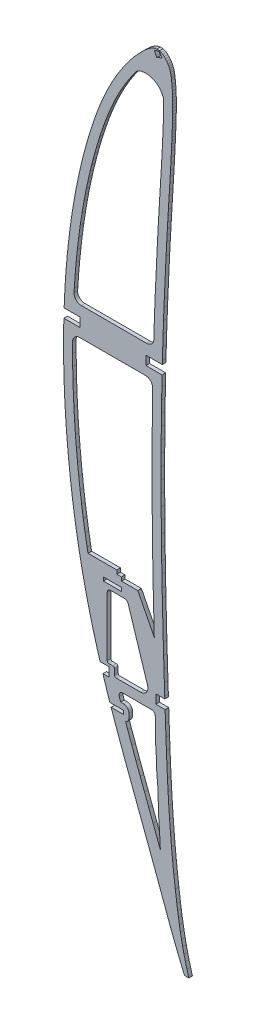
from build123d import *

# Parameters (mm, degrees)
EXTRUDE_1_DEPTH = 2


with BuildPart() as part:
    # Model → 凸台-拉伸1 (new body)
    with BuildSketch(Plane.XY):
        Polygon((54.291294518, 117.084195452), (54.291294518, 119.084195452), (46.872908152, 119.084195452), (45.566594013, 122.943410758), (43.487564441, 129.340813672), (42.984717155, 130.964481072), (46.441341872, 130.964481072), (46.441341872, 135.964481072), (41.441341872, 135.964481072), (40.610906377, 138.784323739), (39.68133891, 141.940780823), (37.91120231, 148.278600749), (36.233061187, 154.641457291), (34.646959161, 161.0283514), (33.154937948, 167.438371268), (31.757996596, 173.871560512), (30.476918009, 180.21872174), (29.288271093, 186.580929102), (28.189015084, 192.959050786), (27.17424198, 199.350870602), (26.243951782, 205.756388547), (25.394235534, 212.173432048), (24.622052473, 218.602869296), (23.929321852, 225.000742168), (23.312388037, 231.404927258), (22.771294649, 237.814425518), (22.307084354, 244.228281519), (21.920668962, 250.648536977), (21.612092093, 257.074192843), (21.383395463, 263.504337309), (21.234273734, 269.945963712), (21.167248438, 276.387170711), (21.18431767, 282.828045546), (21.28548143, 289.268588217), (21.310418054, 290.964481072), (30.408699099, 290.964481072), (30.408699099, 295.964481072), (29.408875314, 295.964481072), (21.485883025, 295.964481072), (21.751300161, 302.144161638), (22.119951326, 308.579366865), (22.585584814, 315.085870262), (23.150734747, 321.582705303), (23.818441889, 328.069003799), (24.592833293, 334.541943081), (25.480989532, 340.99983039), (26.485994993, 347.440798487), (27.611976724, 353.862024705), (28.235877227, 357.133352442), (28.893095277, 360.398127232), (29.582675444, 363.65530641), (30.307658493, 366.904021783), (31.065959088, 370.146184211), (31.859662565, 373.379882835), (32.689767972, 376.605161275), (33.578542915, 379.908072733), (34.507890457, 383.198742292), (35.479808697, 386.47725719), (36.497425636, 389.74075114), (37.562695751, 392.99031043), (38.678747047, 396.223068774), (39.848576666, 399.439157028), (40.477722629, 401.100180917), (41.122159651, 402.754865758), (41.782886781, 404.403255172), (42.461033924, 406.042395634), (43.15751289, 407.674328858), (43.504753325, 408.490251851), (44.24015575, 410.101863552), (45.401366069, 412.586880019), (46.218420336, 414.254106256), (47.058976146, 415.91034716), (47.925075213, 417.554690921), (48.817585727, 419.190178305), (49.737550357, 420.815853881), (50.684881863, 422.433715747), (51.740089589, 424.171397149), (52.827052958, 425.892447885), (53.942992924, 427.591741854), (55.085174058, 429.263153909), (56.251947218, 430.898604426), (57.440489737, 432.493966353), (58.650107903, 434.042202735), (59.402401981, 434.968899351), (60.168294358, 435.882176345), (60.953517606, 436.788289721), (61.765715157, 437.695580821), (62.609664153, 438.609262982), (63.493008026, 439.537677545), (64.421479349, 440.487080517), (65.717066034, 441.762807424), (67.085068203, 443.007663668), (68.506952724, 444.141764812), (69.963143803, 445.086181851), (71.439060883, 445.762203873), (72.913173689, 446.089815584), (74.369946238, 445.989263407), (74.96913356, 445.782849789), (75.262202885, 445.681890544), (76.126951759, 445.202153757), (76.951981987, 444.577546583), (77.72217279, 443.833433603), (78.426355963, 442.996352926), (79.050366155, 442.092711803), (79.581037063, 441.148961101), (79.967566521, 440.297010411), (80.281514413, 439.43388312), (80.531697697, 438.563967995), (80.731147619, 437.68683304), (80.888855612, 436.80287083), (81.016723016, 435.914602893), (81.123697647, 435.023420853), (81.289353677, 433.430130208), (81.427254453, 431.830622979), (81.538311786, 430.226940882), (81.624480152, 428.620170204), (81.687714028, 427.011397231), (81.729012462, 425.400665584), (81.750286313, 423.790060597), (81.752621867, 422.177627794), (81.73892903, 420.565496129), (81.71111866, 418.955750937), (81.67227514, 417.34652498), (81.623441138, 415.736862829), (81.568569227, 414.12793801), (81.508702075, 412.518795094), (81.446967684, 410.906567794), (81.383191578, 409.295252304), (81.316418327, 407.683805956), (81.24764698, 406.072272369), (81.175878488, 404.460607924), (81.1021119, 402.84885624), (81.024349118, 401.236930079), (80.860962028, 398.009731656), (80.686541788, 394.783052469), (80.503042875, 391.557978803), (80.312507005, 388.33359885), (80.117974943, 385.109044419), (79.921444784, 381.88440275), (79.723959196, 378.658718412), (79.528471704, 375.433121314), (79.333983261, 372.207567835), (79.142448343, 368.983144263), (78.953954189, 365.7578525), (78.769456228, 362.532735215), (78.586999983, 359.30670612), (78.409582598, 356.079896075), (78.043082277, 349.175129618), (77.056753567, 328.078030658), (76.880995939, 323.849543907), (76.63301571, 317.401590139), (76.405234542, 310.949513516), (76.199995289, 304.508430622), (76.014737001, 298.068220116), (75.96106674, 295.964481072), (67.89728713, 295.964481072), (66.89728713, 295.964481072), (66.89728713, 290.964481072), (75.835677054, 290.964481072), (75.707204083, 285.189548076), (75.585016691, 278.749088446), (75.48394017, 272.306547679), (75.4039309, 265.862924823), (75.344639927, 259.426212263), (75.305286298, 252.991371139), (75.284870967, 246.558357831), (75.28352479, 240.124175196), (75.299162434, 233.69073409), (75.332870184, 227.256080036), (75.382693563, 220.819126748), (75.448327237, 214.386867563), (75.528903015, 207.956261718), (75.624420896, 201.527309211), (75.734968121, 195.098011947), (75.860457449, 188.670368022), (75.962820782, 183.921690481), (76.502602245, 162.82459152), (76.688193548, 156.529882743), (76.886613396, 150.105423033), (77.09306925, 143.68031323), (77.199815655, 140.467411472), (77.30656206, 137.254509714), (77.350430551, 135.964481072), (72.350430551, 135.964481072), (72.350430551, 130.964481072), (77.520459684, 130.964481072), (77.525137351, 130.826926199), (77.748707882, 124.399560781), (77.982181657, 117.974629654), (78.008994214, 117.289629737), (78.2336383, 111.550483675), (78.50998391, 105.129426277), (78.817300014, 98.709721081), (79.164621667, 92.290761611), (79.557943158, 85.872809585), (80.004563159, 79.449177001), (80.508997099, 73.031071486), (81.072244026, 66.61853666), (81.701297277, 60.211877858), (82.39719952, 53.810139651), (83.165901426, 47.414582804), (84.010443757, 41.024339128), (84.466121807, 37.809155382), (84.948599681, 34.599145554), (85.463871669, 31.394571357), (86.017801202, 28.198691655), (86.618337046, 25.01285445), (87.271429872, 21.838320506), (87.983030348, 18.676350588), (88.772739459, 15.467743332), (89.620868983, 12.273698199), (90.516516627, 9.091737279), (90.678135484, 8.543704345), (88.290044891, 8.543704345), (88.096560118, 8.992085412), (86.754381538, 12.153549418), (85.435787541, 15.325051723), (84.143688033, 18.508721282), (82.902286663, 21.654566262), (81.687554259, 24.808582303), (80.493452914, 27.971506737), (79.315074623, 31.141123371), (78.148554052, 34.314260582), (76.985942436, 37.489570367), (75.823243581, 40.666878248), (73.487205296, 47.013021812), (71.133576717, 53.349388792), (68.768177657, 59.680237099), (66.39396164, 66.006696639), (64.012795905, 72.331851794), (61.629632074, 78.656919711), (59.246293765, 84.985983821), (56.882290525, 91.284862585), (54.536095675, 97.58852269), (52.219523317, 103.901483763), (49.944387552, 110.228265429), (47.955682015, 115.908270321), (47.549892479, 117.084195452), align=None)
        Polygon((43.286670067, 175.595272971), (43.286670067, 177.595272971), (50.744475201, 177.595272971), (53.286670067, 177.595272971), (53.286670067, 175.595272971), align=None, mode=Mode.SUBTRACT)
        with BuildLine():
            Line((72.042587935, 125.21439261), (72.218298993, 117.757054558))
            Line((72.218298993, 117.757054558), (72.3082212, 111.008200621))
            Line((72.3082212, 111.008200621), (72.71110218, 105.094867242))
            Line((72.71110218, 105.094867242), (72.890342146, 98.413249714))
            Line((72.890342146, 98.413249714), (73.471849335, 91.967229934))
            Line((73.471849335, 91.967229934), (73.696859108, 85.832325294))
            Line((73.696859108, 85.832325294), (73.791319576, 79.278176163))
            Line((73.791319576, 79.278176163), (74.314109024, 72.701131933))
            Line((74.314109024, 72.701131933), (74.664835741, 66.384594583))
            Line((74.664835741, 66.384594583), (74.864626279, 62.283566149))
            Line((74.864626279, 62.283566149), (73.204330163, 66.707677572))
            Line((73.204330163, 66.707677572), (70.822801347, 73.033797189))
            Line((70.822801347, 73.033797189), (68.439439292, 79.359391429))
            Line((68.439439292, 79.359391429), (66.056621443, 85.687073528))
            Line((66.056621443, 85.687073528), (63.693966415, 91.982359986))
            Line((63.693966415, 91.982359986), (61.35033172, 98.279141574))
            Line((61.35033172, 98.279141574), (59.037584921, 104.581677502))
            Line((59.037584921, 104.581677502), (56.767495816, 110.894425226))
            Line((56.767495816, 110.894425226), (55.6090916, 114.202980212))
            ThreePointArc((55.6090916, 114.202980212), (56.941486452, 115.308561958), (57.441084292, 116.966267915))
            Line((57.441084292, 116.966267915), (57.441084292, 119.190880387))
            ThreePointArc((57.441084292, 119.190880387), (56.562404636, 121.312200731), (54.441084292, 122.190880387))
            Line((54.441084292, 122.190880387), (52.87012438, 122.190880387))
            Line((52.87012438, 122.190880387), (52.079692184, 124.526036946))
            ThreePointArc((52.079692184, 124.526036946), (52.34891593, 126.332938072), (53.974106504, 127.167281348))
            Line((53.974106504, 127.167281348), (70.04314288, 127.167281348))
            ThreePointArc((70.04314288, 127.167281348), (71.440600836, 126.598054307), (72.042587935, 125.21439261))
        make_face(mode=Mode.SUBTRACT)
        with BuildLine():
            Line((45.360727752, 138.485291105), (45.360727752, 171.110887324))
            ThreePointArc((45.360727752, 171.110887324), (45.94651419, 172.525100886), (47.360727752, 173.110887324))
            Line((47.360727752, 173.110887324), (55.065122353, 173.110887324))
            ThreePointArc((55.065122353, 173.110887324), (56.246164798, 172.724931543), (56.971377085, 171.716026066))
            Line((56.971377085, 171.716026066), (67.749193536, 137.764698555))
            ThreePointArc((67.749193536, 137.764698555), (67.16477251, 134.19233618), (63.936684072, 132.554421072))
            Line((63.936684072, 132.554421072), (50.459020169, 132.554421072))
            ThreePointArc((50.459020169, 132.554421072), (49.751913388, 132.84731429), (49.459020169, 133.554421072))
            Line((49.459020169, 133.554421072), (49.459020169, 136.485291105))
            ThreePointArc((49.459020169, 136.485291105), (49.16612695, 137.192397886), (48.459020169, 137.485291105))
            Line((48.459020169, 137.485291105), (46.360727752, 137.485291105))
            ThreePointArc((46.360727752, 137.485291105), (45.653620971, 137.778184324), (45.360727752, 138.485291105))
        make_face(mode=Mode.SUBTRACT)
        with BuildLine():
            Line((50.744475201, 182.595272971), (53.286670067, 182.595272971))
            Line((53.286670067, 182.595272971), (53.286670067, 180.595272971))
            Line((53.286670067, 180.595272971), (62.370591854, 180.595272971))
            Line((62.370591854, 180.595272971), (71.504237997, 162.66454563))
            Line((71.504237997, 162.66454563), (70.964456534, 183.793804445))
            Line((70.964456534, 183.793804445), (70.861509239, 188.567690842))
            Line((70.861509239, 188.567690842), (70.735807135, 195.006233293))
            Line((70.735807135, 195.006233293), (70.625059432, 201.447190179))
            Line((70.625059432, 201.447190179), (70.529368361, 207.88779943))
            Line((70.529368361, 207.88779943), (70.448646842, 214.330036589))
            Line((70.448646842, 214.330036589), (70.382891001, 220.774268487))
            Line((70.382891001, 220.774268487), (70.332971548, 227.223634038))
            Line((70.332971548, 227.223634038), (70.299194266, 233.671561369))
            Line((70.299194266, 233.671561369), (70.283523519, 240.118621557))
            Line((70.283523519, 240.118621557), (70.284872627, 246.56681468))
            Line((70.284872627, 246.56681468), (70.305334818, 253.014593954))
            Line((70.305334818, 253.014593954), (70.344780756, 259.464528807))
            Line((70.344780756, 259.464528807), (70.404216815, 265.916992066))
            Line((70.404216815, 265.916992066), (70.484427113, 272.37680499))
            Line((70.484427113, 272.37680499), (70.585760642, 278.835727234))
            Line((70.585760642, 278.835727234), (70.609850156, 282.047270632))
            ThreePointArc((70.609850156, 282.047270632), (69.448977583, 284.895073009), (66.609962678, 286.077273448))
            Line((66.609962678, 286.077273448), (30.173635214, 286.077273448))
            ThreePointArc((30.173635214, 286.077273448), (27.367506774, 284.92782483), (26.174128564, 282.140095038))
            Line((26.174128564, 282.140095038), (26.167317378, 276.406559059))
            Line((26.167317378, 276.406559059), (26.233671645, 270.02983872))
            Line((26.233671645, 270.02983872), (26.381338437, 263.651061344))
            Line((26.381338437, 263.651061344), (26.607827749, 257.282978919))
            Line((26.607827749, 257.282978919), (26.913459019, 250.918660782))
            Line((26.913459019, 250.918660782), (27.296229959, 244.55895755))
            Line((27.296229959, 244.55895755), (27.756089749, 238.205211186))
            Line((27.756089749, 238.205211186), (28.292180722, 231.854968819))
            Line((28.292180722, 231.854968819), (28.903448839, 225.509597451))
            Line((28.903448839, 225.509597451), (29.58985731, 219.17011425))
            Line((29.58985731, 219.17011425), (30.35494684, 212.799739962))
            Line((30.35494684, 212.799739962), (31.196558533, 206.443901925))
            Line((31.196558533, 206.443901925), (32.117579249, 200.102209053))
            Line((32.117579249, 200.102209053), (33.121985149, 193.77568984))
            Line((33.121985149, 193.77568984), (34.209669173, 187.464711321))
            Line((34.209669173, 187.464711321), (34.729528894, 184.682173207))
            Line((34.729528894, 184.682173207), (50.744475201, 184.682173207))
            Line((50.744475201, 184.682173207), (50.744475201, 182.595272971))
        make_face(mode=Mode.SUBTRACT)
        with BuildLine():
            Line((72.062208968, 328.31153493), (71.884987502, 324.049443427))
            Line((71.884987502, 324.049443427), (71.636406574, 317.58587035))
            Line((71.636406574, 317.58587035), (71.408044451, 311.11733774))
            Line((71.408044451, 311.11733774), (71.292098389, 305.806582236))
            ThreePointArc((71.292098389, 305.806582236), (70.090439975, 303.034761981), (67.293051348, 301.893890672))
            Line((67.293051348, 301.893890672), (30.980865278, 301.893890672))
            ThreePointArc((30.980865278, 301.893890672), (28.072679794, 303.147537238), (26.987412681, 306.122662078))
            Line((26.987412681, 306.122662078), (27.109734054, 308.25791408))
            Line((27.109734054, 308.25791408), (27.570094832, 314.690739558))
            Line((27.570094832, 314.690739558), (28.128498632, 321.110022587))
            Line((28.128498632, 321.110022587), (28.787936992, 327.515995765))
            Line((28.787936992, 327.515995765), (29.552203475, 333.90430343))
            Line((29.552203475, 333.90430343), (30.428193845, 340.273731283))
            Line((30.428193845, 340.273731283), (31.418971071, 346.623512213))
            Line((31.418971071, 346.623512213), (32.530414155, 352.96182772))
            Line((32.530414155, 352.96182772), (33.142576356, 356.171607453))
            Line((33.142576356, 356.171607453), (33.789840369, 359.386934898))
            Line((33.789840369, 359.386934898), (34.468592447, 362.592968421))
            Line((34.468592447, 362.592968421), (35.1820716, 365.790133785))
            Line((35.1820716, 365.790133785), (35.928343296, 368.980865889))
            Line((35.928343296, 368.980865889), (36.708846598, 372.160784495))
            Line((36.708846598, 372.160784495), (37.525135552, 375.332380708))
            Line((37.525135552, 375.332380708), (38.398746474, 378.578938848))
            Line((38.398746474, 378.578938848), (39.310879064, 381.808653038))
            Line((39.310879064, 381.808653038), (40.263602457, 385.022419084))
            Line((40.263602457, 385.022419084), (41.259947557, 388.217694321))
            Line((41.259947557, 388.217694321), (42.301731713, 391.395610733))
            Line((42.301731713, 391.395610733), (43.391606579, 394.552546334))
            Line((43.391606579, 394.552546334), (44.536096617, 397.698971172))
            Line((44.536096617, 397.698971172), (45.145296733, 399.307335533))
            Line((45.145296733, 399.307335533), (45.772357829, 400.917405181))
            Line((45.772357829, 400.917405181), (46.413654469, 402.517319195))
            Line((46.413654469, 402.517319195), (47.070626749, 404.105278174))
            Line((47.070626749, 404.105278174), (47.744592684, 405.684460684))
            Line((47.744592684, 405.684460684), (48.434610163, 407.249653105))
            Line((48.434610163, 407.249653105), (49.142793265, 408.8016145))
            Line((49.142793265, 408.8016145), (49.906845801, 410.418489619))
            Line((49.906845801, 410.418489619), (50.692886505, 412.022431654))
            Line((50.692886505, 412.022431654), (51.500496031, 413.613754819))
            Line((51.500496031, 413.613754819), (52.331745785, 415.191934959))
            Line((52.331745785, 415.191934959), (53.188117357, 416.761199275))
            Line((53.188117357, 416.761199275), (54.070927163, 418.321218317))
            Line((54.070927163, 418.321218317), (54.979391217, 419.872701973))
            Line((54.979391217, 419.872701973), (55.991015864, 421.538612194))
            Line((55.991015864, 421.538612194), (57.030796486, 423.18495581))
            Line((57.030796486, 423.18495581), (58.097108113, 424.808678387))
            Line((58.097108113, 424.808678387), (59.184836396, 426.400406801))
            Line((59.184836396, 426.400406801), (60.292339623, 427.952779437))
            Line((60.292339623, 427.952779437), (61.415839769, 429.46083601))
            Line((61.415839769, 429.46083601), (61.558714508, 429.643706833))
            Line((61.558714508, 429.643706833), (61.56488494, 429.651719936))
            Line((61.56488494, 429.651719936), (61.57488494, 429.659719936))
            Line((61.57488494, 429.659719936), (61.58488494, 429.667719936))
            Line((61.58488494, 429.667719936), (61.59488494, 429.675719936))
            Line((61.59488494, 429.675719936), (61.59488494, 429.683719936))
            Line((61.59488494, 429.683719936), (61.60488494, 429.691719936))
            Line((61.60488494, 429.691719936), (61.61488494, 429.699719936))
            Line((61.61488494, 429.699719936), (61.62488494, 429.707719936))
            Line((61.62488494, 429.707719936), (61.63488494, 429.715719936))
            Line((61.63488494, 429.715719936), (61.63488494, 429.723719936))
            Line((61.63488494, 429.723719936), (61.64488494, 429.731719936))
            Line((61.64488494, 429.731719936), (61.65488494, 429.739719936))
            Line((61.65488494, 429.739719936), (61.66488494, 429.747719936))
            Line((61.66488494, 429.747719936), (61.67488494, 429.755719936))
            Line((61.67488494, 429.755719936), (61.68488494, 429.763719936))
            Line((61.68488494, 429.763719936), (61.68488494, 429.771719936))
            Line((61.68488494, 429.771719936), (61.69488494, 429.779719936))
            Line((61.69488494, 429.779719936), (61.70488494, 429.786719936))
            Line((61.70488494, 429.786719936), (61.71488494, 429.794719936))
            Line((61.71488494, 429.794719936), (61.72488494, 429.802719936))
            Line((61.72488494, 429.802719936), (61.73488494, 429.810719936))
            Line((61.73488494, 429.810719936), (61.73488494, 429.817719936))
            Line((61.73488494, 429.817719936), (61.74488494, 429.825719936))
            Line((61.74488494, 429.825719936), (61.75488494, 429.833719936))
            Line((61.75488494, 429.833719936), (61.76488494, 429.841719936))
            Line((61.76488494, 429.841719936), (61.77488494, 429.848719936))
            Line((61.77488494, 429.848719936), (61.78488494, 429.856719936))
            Line((61.78488494, 429.856719936), (61.79488494, 429.864719936))
            Line((61.79488494, 429.864719936), (61.79488494, 429.871719936))
            Line((61.79488494, 429.871719936), (61.80488494, 429.879719936))
            Line((61.80488494, 429.879719936), (61.81488494, 429.886719936))
            Line((61.81488494, 429.886719936), (61.82488494, 429.894719936))
            Line((61.82488494, 429.894719936), (61.83488494, 429.901719936))
            Line((61.83488494, 429.901719936), (61.84488494, 429.909719936))
            Line((61.84488494, 429.909719936), (61.85488494, 429.916719936))
            Line((61.85488494, 429.916719936), (61.85488494, 429.924719936))
            Line((61.85488494, 429.924719936), (61.86488494, 429.931719936))
            Line((61.86488494, 429.931719936), (61.87488494, 429.939719936))
            Line((61.87488494, 429.939719936), (61.88488494, 429.946719936))
            Line((61.88488494, 429.946719936), (61.89488494, 429.954719936))
            Line((61.89488494, 429.954719936), (61.90488494, 429.961719936))
            Line((61.90488494, 429.961719936), (61.91488494, 429.968719936))
            Line((61.91488494, 429.968719936), (61.91488494, 429.976719936))
            Line((61.91488494, 429.976719936), (61.92488494, 429.983719936))
            Line((61.92488494, 429.983719936), (61.93488494, 429.990719936))
            Line((61.93488494, 429.990719936), (61.94488494, 429.998719936))
            Line((61.94488494, 429.998719936), (61.95488494, 430.005719936))
            Line((61.95488494, 430.005719936), (61.96488494, 430.012719936))
            Line((61.96488494, 430.012719936), (61.97488494, 430.020719936))
            Line((61.97488494, 430.020719936), (61.98488494, 430.027719936))
            Line((61.98488494, 430.027719936), (61.99488494, 430.034719936))
            Line((61.99488494, 430.034719936), (61.99488494, 430.041719936))
            Line((61.99488494, 430.041719936), (62.00488494, 430.048719936))
            Line((62.00488494, 430.048719936), (62.01488494, 430.056719936))
            Line((62.01488494, 430.056719936), (62.02488494, 430.063719936))
            Line((62.02488494, 430.063719936), (62.03488494, 430.070719936))
            Line((62.03488494, 430.070719936), (62.04488494, 430.077719936))
            Line((62.04488494, 430.077719936), (62.05488494, 430.084719936))
            Line((62.05488494, 430.084719936), (62.06488494, 430.091719936))
            Line((62.06488494, 430.091719936), (62.07488494, 430.098719936))
            Line((62.07488494, 430.098719936), (62.08488494, 430.105719936))
            Line((62.08488494, 430.105719936), (62.08488494, 430.112719936))
            Line((62.08488494, 430.112719936), (62.09488494, 430.119719936))
            Line((62.09488494, 430.119719936), (62.10488494, 430.126719936))
            Line((62.10488494, 430.126719936), (62.11488494, 430.133719936))
            Line((62.11488494, 430.133719936), (62.12488494, 430.140719936))
            Line((62.12488494, 430.140719936), (62.13488494, 430.147719936))
            Line((62.13488494, 430.147719936), (62.14488494, 430.154719936))
            Line((62.14488494, 430.154719936), (62.15488494, 430.161719936))
            Line((62.15488494, 430.161719936), (62.16488494, 430.168719936))
            Line((62.16488494, 430.168719936), (62.17488494, 430.175719936))
            Line((62.17488494, 430.175719936), (62.18488494, 430.181719936))
            Line((62.18488494, 430.181719936), (62.18488494, 430.188719936))
            Line((62.18488494, 430.188719936), (62.19488494, 430.195719936))
            Line((62.19488494, 430.195719936), (62.20488494, 430.202719936))
            Line((62.20488494, 430.202719936), (62.21488494, 430.209719936))
            Line((62.21488494, 430.209719936), (62.22488494, 430.215719936))
            Line((62.22488494, 430.215719936), (62.23488494, 430.222719936))
            Line((62.23488494, 430.222719936), (62.24488494, 430.229719936))
            Line((62.24488494, 430.229719936), (62.25488494, 430.235719936))
            Line((62.25488494, 430.235719936), (62.26488494, 430.242719936))
            Line((62.26488494, 430.242719936), (62.27488494, 430.249719936))
            Line((62.27488494, 430.249719936), (62.28488494, 430.255719936))
            Line((62.28488494, 430.255719936), (62.29488494, 430.262719936))
            Line((62.29488494, 430.262719936), (62.30488494, 430.269719936))
            Line((62.30488494, 430.269719936), (62.30488494, 430.275719936))
            Line((62.30488494, 430.275719936), (62.31488494, 430.282719936))
            Line((62.31488494, 430.282719936), (62.32488494, 430.288719936))
            Line((62.32488494, 430.288719936), (62.33488494, 430.295719936))
            Line((62.33488494, 430.295719936), (62.34488494, 430.302719936))
            Line((62.34488494, 430.302719936), (62.35488494, 430.308719936))
            Line((62.35488494, 430.308719936), (62.36488494, 430.315719936))
            Line((62.36488494, 430.315719936), (62.37488494, 430.321719936))
            Line((62.37488494, 430.321719936), (62.38488494, 430.327719936))
            Line((62.38488494, 430.327719936), (62.39488494, 430.334719936))
            Line((62.39488494, 430.334719936), (62.40488494, 430.340719936))
            Line((62.40488494, 430.340719936), (62.41488494, 430.347719936))
            Line((62.41488494, 430.347719936), (62.42488494, 430.353719936))
            Line((62.42488494, 430.353719936), (62.43488494, 430.360719936))
            Line((62.43488494, 430.360719936), (62.44488494, 430.366719936))
            Line((62.44488494, 430.366719936), (62.45488494, 430.372719936))
            Line((62.45488494, 430.372719936), (62.45488494, 430.379719936))
            Line((62.45488494, 430.379719936), (62.46488494, 430.385719936))
            Line((62.46488494, 430.385719936), (62.47488494, 430.391719936))
            Line((62.47488494, 430.391719936), (62.48488494, 430.398719936))
            Line((62.48488494, 430.398719936), (62.49488494, 430.404719936))
            Line((62.49488494, 430.404719936), (62.50488494, 430.410719936))
            Line((62.50488494, 430.410719936), (62.51488494, 430.416719936))
            Line((62.51488494, 430.416719936), (62.52488494, 430.423719936))
            Line((62.52488494, 430.423719936), (62.53488494, 430.429719936))
            Line((62.53488494, 430.429719936), (62.54488494, 430.435719936))
            Line((62.54488494, 430.435719936), (62.55488494, 430.441719936))
            Line((62.55488494, 430.441719936), (62.56488494, 430.448719936))
            Line((62.56488494, 430.448719936), (62.57488494, 430.454719936))
            Line((62.57488494, 430.454719936), (62.58488494, 430.460719936))
            Line((62.58488494, 430.460719936), (62.59488494, 430.466719936))
            Line((62.59488494, 430.466719936), (62.60488494, 430.472719936))
            Line((62.60488494, 430.472719936), (62.61488494, 430.479719936))
            Line((62.61488494, 430.479719936), (62.62488494, 430.485719936))
            Line((62.62488494, 430.485719936), (62.63488494, 430.491719936))
            Line((62.63488494, 430.491719936), (62.64488494, 430.497719936))
            Line((62.64488494, 430.497719936), (62.65488494, 430.503719936))
            Line((62.65488494, 430.503719936), (62.66488494, 430.509719936))
            Line((62.66488494, 430.509719936), (62.67488494, 430.515719936))
            Line((62.67488494, 430.515719936), (62.68488494, 430.521719936))
            Line((62.68488494, 430.521719936), (62.68488494, 430.527719936))
            Line((62.68488494, 430.527719936), (62.69488494, 430.533719936))
            Line((62.69488494, 430.533719936), (62.70488494, 430.539719936))
            Line((62.70488494, 430.539719936), (62.71488494, 430.545719936))
            Line((62.71488494, 430.545719936), (62.72488494, 430.551719936))
            Line((62.72488494, 430.551719936), (62.73488494, 430.558719936))
            Line((62.73488494, 430.558719936), (62.74488494, 430.564719936))
            Line((62.74488494, 430.564719936), (62.75488494, 430.570719936))
            Line((62.75488494, 430.570719936), (62.76488494, 430.576719936))
            Line((62.76488494, 430.576719936), (62.77488494, 430.582719936))
            Line((62.77488494, 430.582719936), (62.78488494, 430.587719936))
            Line((62.78488494, 430.587719936), (62.79488494, 430.593719936))
            Line((62.79488494, 430.593719936), (62.80488494, 430.599719936))
            Line((62.80488494, 430.599719936), (62.81488494, 430.605719936))
            Line((62.81488494, 430.605719936), (62.82488494, 430.611719936))
            Line((62.82488494, 430.611719936), (62.83488494, 430.617719936))
            Line((62.83488494, 430.617719936), (62.84488494, 430.623719936))
            Line((62.84488494, 430.623719936), (62.85488494, 430.629719936))
            Line((62.85488494, 430.629719936), (62.86488494, 430.635719936))
            Line((62.86488494, 430.635719936), (62.87488494, 430.641719936))
            Line((62.87488494, 430.641719936), (62.88488494, 430.647719936))
            Line((62.88488494, 430.647719936), (62.89488494, 430.653719936))
            Line((62.89488494, 430.653719936), (62.90488494, 430.659719936))
            Line((62.90488494, 430.659719936), (62.91488494, 430.665719936))
            Line((62.91488494, 430.665719936), (62.92488494, 430.670719936))
            Line((62.92488494, 430.670719936), (62.93488494, 430.676719936))
            Line((62.93488494, 430.676719936), (62.94488494, 430.682719936))
            Line((62.94488494, 430.682719936), (62.95488494, 430.688719936))
            Line((62.95488494, 430.688719936), (62.96488494, 430.694719936))
            Line((62.96488494, 430.694719936), (62.97488494, 430.700719936))
            Line((62.97488494, 430.700719936), (62.98488494, 430.706719936))
            Line((62.98488494, 430.706719936), (62.99488494, 430.712719936))
            Line((62.99488494, 430.712719936), (63.00488494, 430.717719936))
            Line((63.00488494, 430.717719936), (63.01488494, 430.723719936))
            ThreePointArc((63.01488494, 430.723719936), (71.467989025, 430.299328211), (76.750431224, 423.686395319))
            Line((76.750431224, 423.686395319), (76.752591111, 422.195240357))
            Line((76.752591111, 422.195240357), (76.739295828, 420.629914856))
            Line((76.739295828, 420.629914856), (76.712160858, 419.059263815))
            Line((76.712160858, 419.059263815), (76.674104868, 417.482663983))
            Line((76.674104868, 417.482663983), (76.626025798, 415.897885859))
            Line((76.626025798, 415.897885859), (76.571738314, 414.30609729))
            Line((76.571738314, 414.30609729), (76.512259789, 412.707400094))
            Line((76.512259789, 412.707400094), (76.450752326, 411.101099149))
            Line((76.450752326, 411.101099149), (76.387286729, 409.497628722))
            Line((76.387286729, 409.497628722), (76.32083321, 407.893898498))
            Line((76.32083321, 407.893898498), (76.252391022, 406.29007818))
            Line((76.252391022, 406.29007818), (76.180965905, 404.686124714))
            Line((76.180965905, 404.686124714), (76.107622629, 403.083622124))
            Line((76.107622629, 403.083622124), (76.030443974, 401.483804177))
            Line((76.030443974, 401.483804177), (75.867789841, 398.271083013))
            Line((75.867789841, 398.271083013), (75.694213172, 395.060009423))
            Line((75.694213172, 395.060009423), (75.511427245, 391.847466803))
            Line((75.511427245, 391.847466803), (75.321395589, 388.63161951))
            Line((75.321395589, 388.63161951), (75.127048957, 385.410138771))
            Line((75.127048957, 385.410138771), (74.93070514, 382.188570144))
            Line((74.93070514, 382.188570144), (74.733303529, 378.964260575))
            Line((74.733303529, 378.964260575), (74.537628918, 375.735591619))
            Line((74.537628918, 375.735591619), (74.343047616, 372.508502019))
            Line((74.343047616, 372.508502019), (74.15124635, 369.279628097))
            Line((74.15124635, 369.279628097), (73.962291528, 366.046493042))
            Line((73.962291528, 366.046493042), (73.777617687, 362.818301274))
            Line((73.777617687, 362.818301274), (73.59475605, 359.585122932))
            Line((73.59475605, 359.585122932), (73.416862717, 356.349656495))
            Line((73.416862717, 356.349656495), (73.048537677, 349.40863389))
            Line((73.048537677, 349.40863389), (72.062208968, 328.31153493))
        make_face(mode=Mode.SUBTRACT)
        Polygon((74.364727391, 445.97361925), (71.658572771, 444.678734246), (72.953457775, 441.972579626), (75.659612395, 443.26746463), align=None, mode=Mode.SUBTRACT)
    extrude(amount=EXTRUDE_1_DEPTH)


solid = part.part
